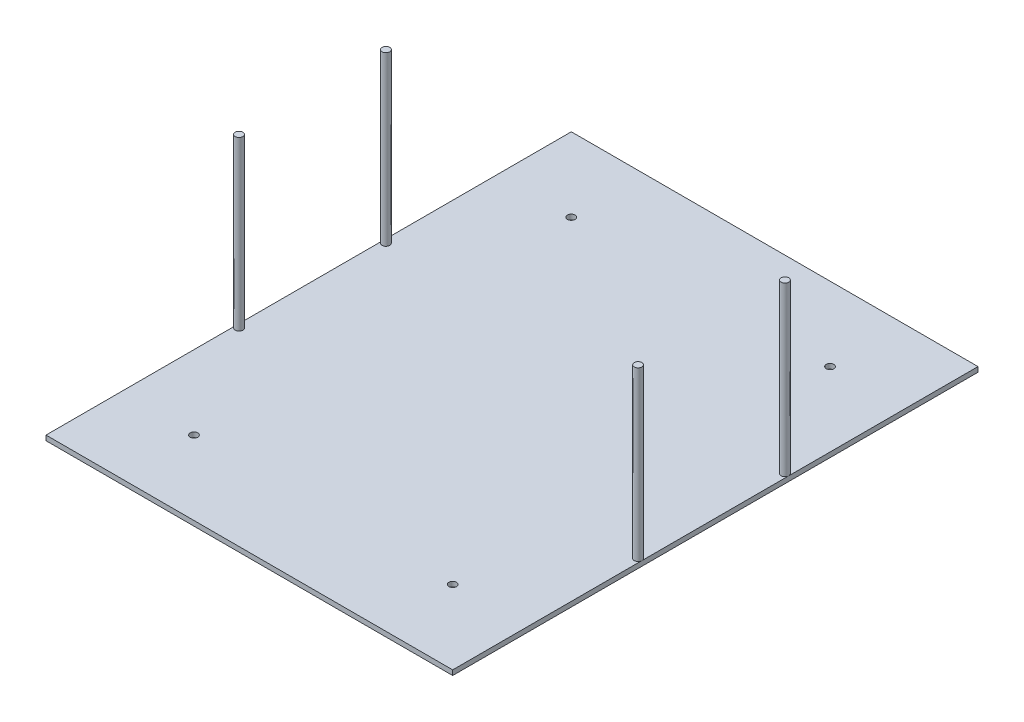
from build123d import *

# Parameters (mm, degrees)
SKETCH1_R             = 1.55
BOSS_EXTRUDE1_DEPTH   = 70
BOSS_EXTRUDE1_2_DEPTH = 70
BOSS_EXTRUDE1_3_DEPTH = 70
BOSS_EXTRUDE1_4_DEPTH = 70
SKETCH2_W             = 164.9
SKETCH2_H             = 213
BOSS_EXTRUDE2_DEPTH   = 2
SKETCH3_R             = 1.55
CUT_EXTRUDE1_DEPTH    = 10


with BuildPart() as part:
    # Sketch1 → Boss-Extrude1 (new body)
    with BuildSketch(Plane(origin=(0, 0, 0), x_dir=(1, 0, 0), z_dir=(0, 1, 0))):
        with Locations(Location((-80.9, 29.78, 0), (0, 0, 270))):
            Circle(SKETCH1_R)
    extrude(amount=BOSS_EXTRUDE1_DEPTH)



with BuildPart() as body_2:
    # Sketch1 → Boss-Extrude1 2 (new body)
    with BuildSketch(Plane(origin=(0, 0, 0), x_dir=(1, 0, 0), z_dir=(0, 1, 0))):
        with Locations(Location((-80.9, -29.78, 0), (0, 0, 270))):
            Circle(SKETCH1_R)
    extrude(amount=BOSS_EXTRUDE1_2_DEPTH)


with BuildPart() as body_3:
    # Sketch1 → Boss-Extrude1 3 (new body)
    with BuildSketch(Plane(origin=(0, 0, 0), x_dir=(1, 0, 0), z_dir=(0, 1, 0))):
        with Locations(Location((80.9, 29.78, 0), (0, 0, 270))):
            Circle(SKETCH1_R)
    extrude(amount=BOSS_EXTRUDE1_3_DEPTH)


with BuildPart() as body_4:
    # Sketch1 → Boss-Extrude1 4 (new body)
    with BuildSketch(Plane(origin=(0, 0, 0), x_dir=(1, 0, 0), z_dir=(0, 1, 0))):
        with Locations(Location((80.9, -29.78, 0), (0, 0, 270))):
            Circle(SKETCH1_R)
    extrude(amount=BOSS_EXTRUDE1_4_DEPTH)


with BuildPart() as part_1:
    add(part.part)

    add(body_2.part)  # Boss-Extrude2 merges body 2

    add(body_3.part)  # Boss-Extrude2 merges body 3

    add(body_4.part)  # Boss-Extrude2 merges body 4
    # Sketch2 → Boss-Extrude2 (add)
    with BuildSketch(Plane(origin=(0, 0, 0), x_dir=(1, 0, 0), z_dir=(0, 1, 0))):
        Rectangle(SKETCH2_W, SKETCH2_H)
    extrude(amount=BOSS_EXTRUDE2_DEPTH)

    # Sketch3 → Cut-Extrude1 (cut)
    with BuildSketch(Plane(origin=(0, 2, 0), x_dir=(1, 0, 0), z_dir=(0, 1, 0))):
        with Locations(Location((-52.45, 76.5, 0), (0, 0, 270))):
            Circle(SKETCH3_R)
        with Locations(Location((52.45, 76.5, 0), (0, 0, 270))):
            Circle(SKETCH3_R)
        with Locations(Location((52.45, -76.5, 0), (0, 0, 270))):
            Circle(SKETCH3_R)
        with Locations(Location((-52.45, -76.5, 0), (0, 0, 270))):
            Circle(SKETCH3_R)
    extrude(amount=-CUT_EXTRUDE1_DEPTH, mode=Mode.SUBTRACT)


solid = part_1.part
